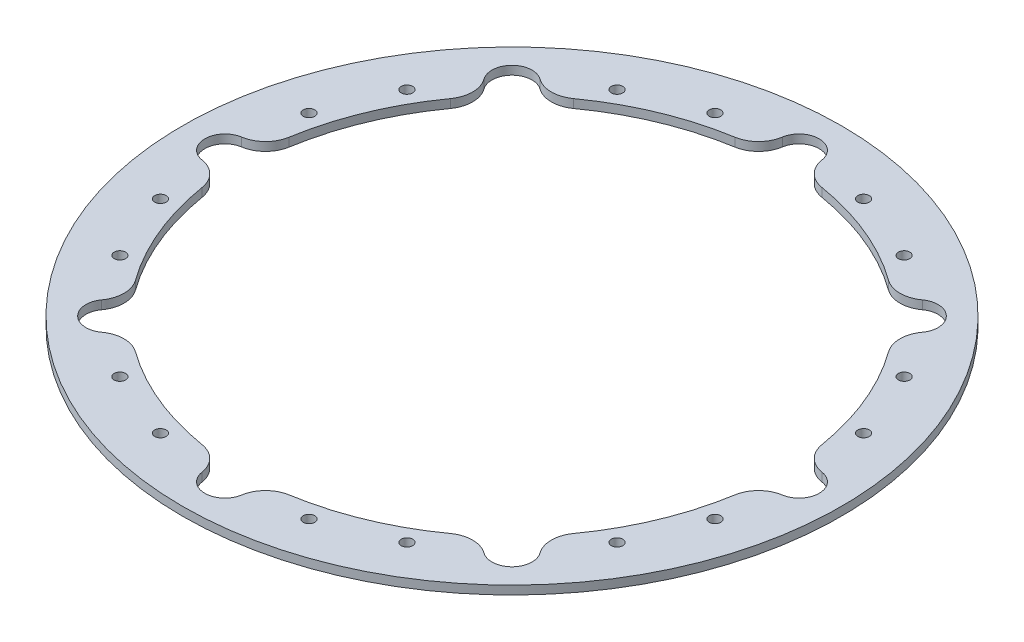
from build123d import *

# Parameters (mm, degrees)
SKETCH1_R           = 115
BOSS_EXTRUDE1_DEPTH = 3
SKETCH2_R           = 2
CUT_EXTRUDE1_DEPTH  = 3
FILLET1_R           = 10


with BuildPart() as part:
    # Sketch1 → Boss-Extrude1 (new body)
    with BuildSketch(Plane(origin=(0, 0, 0), x_dir=(1, 0, 0), z_dir=(0, 1, 0))):
        with Locations(Location((0, 0, 0), (0, 0, 270))):
            Circle(SKETCH1_R)
        with BuildLine():
            ThreePointArc((71.353771819, 61.454276883), (87.001735577, 36.037298826), (93.909471833, 7))
            Line((93.909471833, 7), (100.17, 7))
            ThreePointArc((100.17, 7), (107.17, 0), (100.17, -7))
            Line((100.17, -7), (93.909471833, -7))
            ThreePointArc((93.909471833, -7), (87.001735577, -36.037298826), (71.353771819, -61.454276883))
            Line((71.353771819, -61.454276883), (75.78063374, -65.881138803))
            ThreePointArc((75.78063374, -65.881138803), (75.78063374, -75.78063374), (65.881138803, -75.78063374))
            Line((65.881138803, -75.78063374), (61.454276883, -71.353771819))
            ThreePointArc((61.454276883, -71.353771819), (36.037298826, -87.001735577), (7, -93.909471833))
            Line((7, -93.909471833), (7, -100.17))
            ThreePointArc((7, -100.17), (0, -107.17), (-7, -100.17))
            Line((-7, -100.17), (-7, -93.909471833))
            ThreePointArc((-7, -93.909471833), (-36.037298826, -87.001735577), (-61.454276883, -71.353771819))
            Line((-61.454276883, -71.353771819), (-65.881138803, -75.78063374))
            ThreePointArc((-65.881138803, -75.78063374), (-75.78063374, -75.78063374), (-75.78063374, -65.881138803))
            Line((-75.78063374, -65.881138803), (-71.353771819, -61.454276883))
            ThreePointArc((-71.353771819, -61.454276883), (-87.001735577, -36.037298826), (-93.909471833, -7))
            Line((-93.909471833, -7), (-100.17, -7))
            ThreePointArc((-100.17, -7), (-107.17, 0), (-100.17, 7))
            Line((-100.17, 7), (-93.909471833, 7))
            ThreePointArc((-93.909471833, 7), (-87.001735577, 36.037298826), (-71.353771819, 61.454276883))
            Line((-71.353771819, 61.454276883), (-75.78063374, 65.881138803))
            ThreePointArc((-75.78063374, 65.881138803), (-75.78063374, 75.78063374), (-65.881138803, 75.78063374))
            Line((-65.881138803, 75.78063374), (-61.454276883, 71.353771819))
            ThreePointArc((-61.454276883, 71.353771819), (-36.037298826, 87.001735577), (-7, 93.909471833))
            Line((-7, 93.909471833), (-7, 100.17))
            ThreePointArc((-7, 100.17), (0, 107.17), (7, 100.17))
            Line((7, 100.17), (7, 93.909471833))
            ThreePointArc((7, 93.909471833), (36.037298826, 87.001735577), (61.454276883, 71.353771819))
            Line((61.454276883, 71.353771819), (65.881138803, 75.78063374))
            ThreePointArc((65.881138803, 75.78063374), (75.78063374, 75.78063374), (75.78063374, 65.881138803))
            Line((75.78063374, 65.881138803), (71.353771819, 61.454276883))
        make_face(mode=Mode.SUBTRACT)
    extrude(amount=BOSS_EXTRUDE1_DEPTH)

    # Sketch2 → Cut-Extrude1 (cut)
    with BuildSketch(Plane(origin=(0, 3, 0), x_dir=(1, 0, 0), z_dir=(0, 1, 0))):
        with Locations(Location((96.756790019, 25.925903748, 0), (0, 0, 270))):
            Circle(SKETCH2_R)
        with Locations(Location((86.749764697, -50.085, 0), (0, 0, 270))):
            Circle(SKETCH2_R)
        with Locations(Location((25.925903748, -96.756790019, 0), (0, 0, 270))):
            Circle(SKETCH2_R)
        with Locations(Location((-50.085, -86.749764697, 0), (0, 0, 270))):
            Circle(SKETCH2_R)
        with Locations(Location((-96.756790019, -25.925903748, 0), (0, 0, 270))):
            Circle(SKETCH2_R)
        with Locations(Location((-86.749764697, 50.085, 0), (0, 0, 270))):
            Circle(SKETCH2_R)
        with Locations(Location((-25.925903748, 96.756790019, 0), (0, 0, 270))):
            Circle(SKETCH2_R)
        with Locations(Location((50.085, 86.749764697, 0), (0, 0, 270))):
            Circle(SKETCH2_R)
        with Locations(Location((86.749764697, 50.085, 0), (0, 0, 270))):
            Circle(SKETCH2_R)
        with Locations(Location((96.756790019, -25.925903748, 0), (0, 0, 270))):
            Circle(SKETCH2_R)
        with Locations(Location((50.085, -86.749764697, 0), (0, 0, 270))):
            Circle(SKETCH2_R)
        with Locations(Location((-25.925903748, -96.756790019, 0), (0, 0, 270))):
            Circle(SKETCH2_R)
        with Locations(Location((-86.749764697, -50.085, 0), (0, 0, 270))):
            Circle(SKETCH2_R)
        with Locations(Location((-96.756790019, 25.925903748, 0), (0, 0, 270))):
            Circle(SKETCH2_R)
        with Locations(Location((-50.085, 86.749764697, 0), (0, 0, 270))):
            Circle(SKETCH2_R)
        with Locations(Location((25.925903748, 96.756790019, 0), (0, 0, 270))):
            Circle(SKETCH2_R)
    extrude(amount=-CUT_EXTRUDE1_DEPTH, mode=Mode.SUBTRACT)

    # Fillet1
    fillet1_edges = [part.edges().sort_by_distance(p)[0] for p in [
        (-61.454276883, 1.5, -71.353771819),
        (-71.353771819, 1.5, -61.454276883),
        (-93.909471833, 1.5, -7),
        (-93.909471833, 1.5, 7),
        (-71.353771819, 1.5, 61.454276883),
        (-61.454276883, 1.5, 71.353771819),
        (-7, 1.5, 93.909471833),
        (7, 1.5, 93.909471833),
        (61.454276883, 1.5, 71.353771819),
        (71.353771819, 1.5, 61.454276883),
        (93.909471833, 1.5, 7),
        (93.909471833, 1.5, -7),
        (71.353771819, 1.5, -61.454276883),
        (61.454276883, 1.5, -71.353771819),
        (7, 1.5, -93.909471833),
        (-7, 1.5, -93.909471833),
    ]]
    fillet(fillet1_edges, radius=FILLET1_R)


solid = part.part
